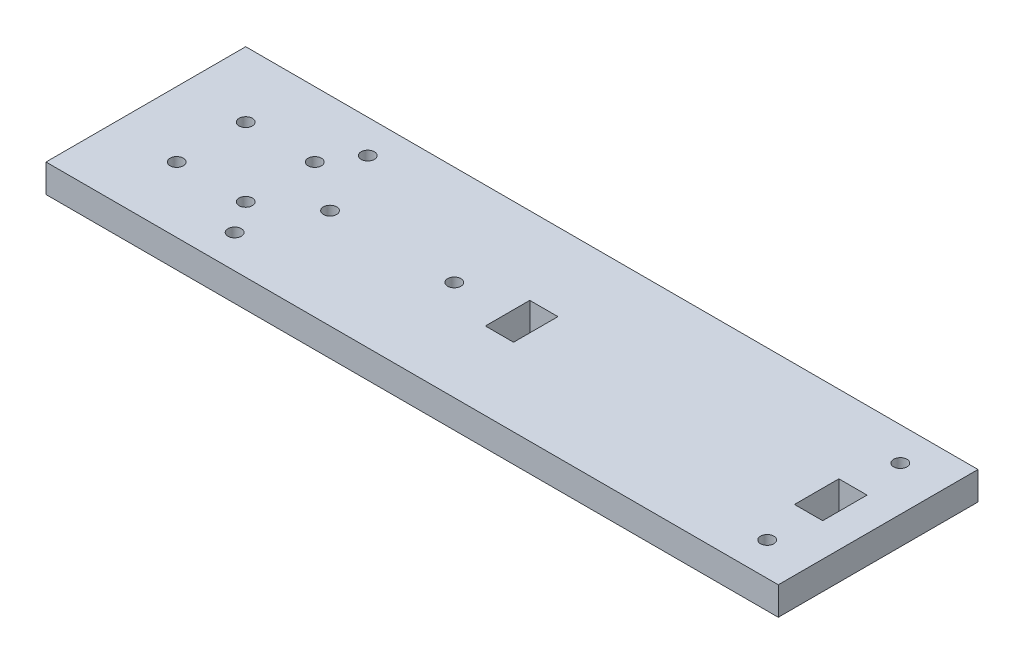
from build123d import *

# Parameters (mm, degrees)
SKETCH1_W           = 165
SKETCH1_H           = 45
SKETCH1_R           = 1.5
SKETCH1_W_2         = 6.35
SKETCH1_H_2         = 10
BOSS_EXTRUDE1_DEPTH = 6.35


with BuildPart() as part:
    # Sketch1 → Boss-Extrude1 (new body)
    with BuildSketch(Plane(origin=(0, 0, 0), x_dir=(1, 0, 0), z_dir=(0, 1, 0))):
        with Locations((82.5, 22.5)):
            Rectangle(SKETCH1_W, SKETCH1_H)
        with Locations(Location((14.721825407, 30.278174593, 0), (0, 0, 270))):
            Circle(SKETCH1_R, mode=Mode.SUBTRACT)
        with Locations(Location((14.721825407, 14.721825407, 0), (0, 0, 270))):
            Circle(SKETCH1_R, mode=Mode.SUBTRACT)
        with Locations(Location((30.278174593, 30.278174593, 0), (0, 0, 270))):
            Circle(SKETCH1_R, mode=Mode.SUBTRACT)
        with Locations(Location((30.278174593, 14.721825407, 0), (0, 0, 270))):
            Circle(SKETCH1_R, mode=Mode.SUBTRACT)
        with Locations(Location((41.5, 22.5, 0), (0, 0, 270))):
            Circle(SKETCH1_R, mode=Mode.SUBTRACT)
        with Locations(Location((69.5, 22.5, 0), (0, 0, 270))):
            Circle(SKETCH1_R, mode=Mode.SUBTRACT)
        with Locations(Location((155, 7.5, 0), (0, 0, 270))):
            Circle(SKETCH1_R, mode=Mode.SUBTRACT)
        with Locations(Location((155, 37.5, 0), (0, 0, 270))):
            Circle(SKETCH1_R, mode=Mode.SUBTRACT)
        with Locations(Location((35, 37.5, 0), (0, 0, 270))):
            Circle(SKETCH1_R, mode=Mode.SUBTRACT)
        with Locations(Location((35, 7.5, 0), (0, 0, 270))):
            Circle(SKETCH1_R, mode=Mode.SUBTRACT)
        with Locations((84.675, 22.5)):
            Rectangle(SKETCH1_W_2, SKETCH1_H_2, mode=Mode.SUBTRACT)
        with Locations((154.325, 22.5)):
            Rectangle(SKETCH1_W_2, SKETCH1_H_2, mode=Mode.SUBTRACT)
    extrude(amount=BOSS_EXTRUDE1_DEPTH)


solid = part.part
